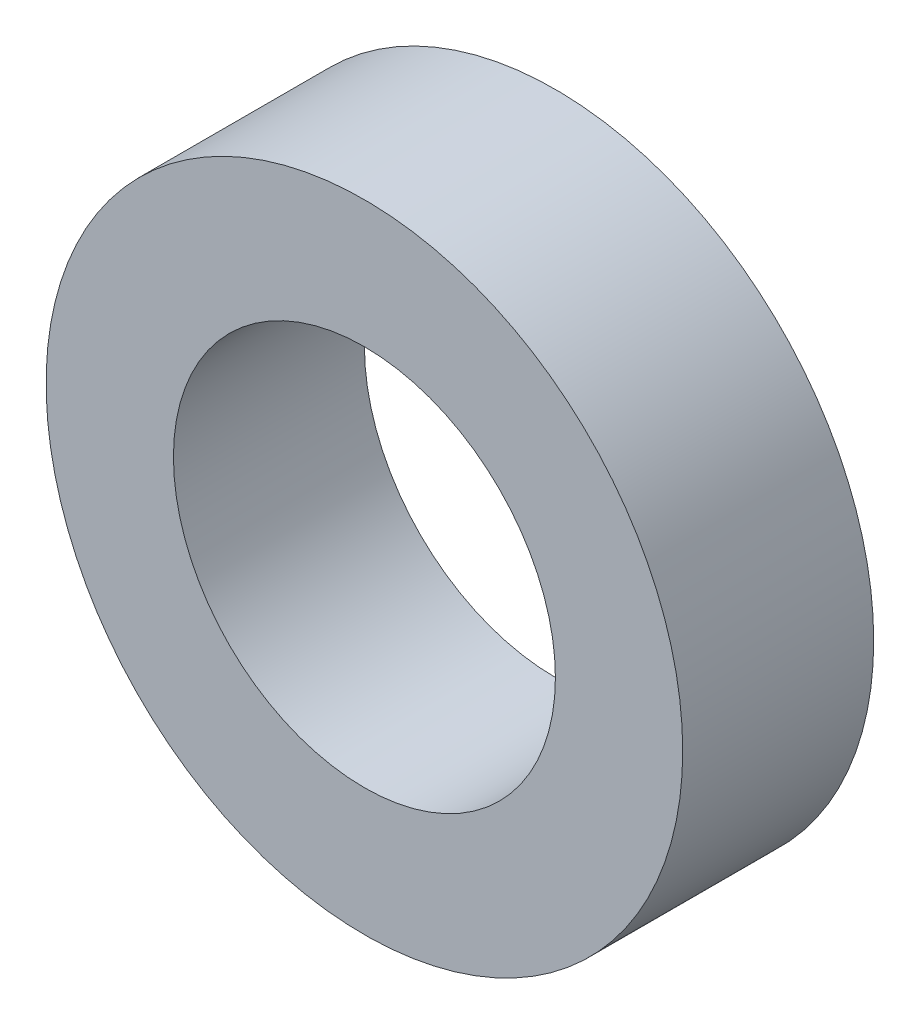
from build123d import *

# Parameters (mm, degrees)
SKETCH_1_R      = 25
SKETCH_1_R_2    = 15
EXTRUDE_1_DEPTH = 15


with BuildPart() as part:
    # 스케치1 → 보스-돌출1 (new body)
    with BuildSketch(Plane.XY):
        Circle(SKETCH_1_R)
        Circle(SKETCH_1_R_2, mode=Mode.SUBTRACT)
    extrude(amount=EXTRUDE_1_DEPTH)


solid = part.part
